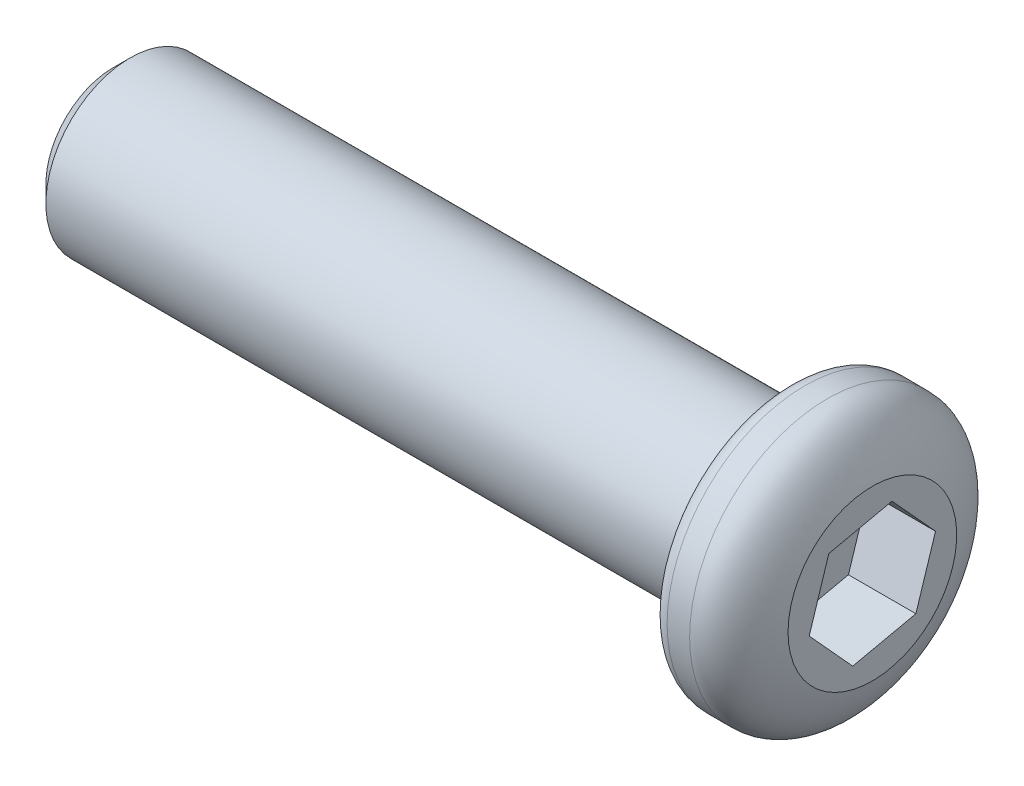
from build123d import *

# Parameters (mm, degrees)
CUT_EXTRUDE1_DEPTH = 1.2
CHAMFER1_SIZE      = 0.3
FILLET1_R          = 0.3


with BuildPart() as part:
    # Sketch1 → Revolve1 (revolve)
    with BuildSketch(Plane(origin=(0, 0, 0), x_dir=(1, 0, 0), z_dir=(0, 1, 0)), mode=Mode.PRIVATE) as revolve1_sk:
        with BuildLine():
            Line((0, 0), (0, 1.5))
            Line((0, 1.5), (12, 1.5))
            Line((12, 1.5), (12, 2.45))
            Line((12, 2.45), (12.7, 2.45))
            add(Edge.make_bspline(
                [(12.7, 2.45), (13.190442748, 2.484618279), (13.5, 1.5)],
                knots=[0, 0, 0, 0.615019669, 0.615019669, 0.615019669], degree=2))
            Line((13.5, 1.5), (13.5, 0))
            Line((13.5, 0), (0, 0))
        make_face()
    revolve(revolve1_sk.sketch.rotate(Axis((-60.710951108, 0, 0), (1, 0, 0)), 180), axis=Axis((-60.710951108, 0, 0), (1, 0, 0)))

    # Sketch2 → Cut-Extrude1 (cut)
    with BuildSketch(Plane(origin=(13.5, 0, 0), x_dir=(0, 0, -1), z_dir=(1, 0, 0))):
        Polygon((0.349309187, 1.095665593), (-0.774219644, 0.850343426), (-1.123528831, -0.245322167), (-0.349309187, -1.095665593), (0.774219644, -0.850343426), (1.123528831, 0.245322167), align=None)
    extrude(amount=-CUT_EXTRUDE1_DEPTH, mode=Mode.SUBTRACT)

    # Chamfer1
    chamfer1_edges = [part.edges().sort_by_distance(p)[0] for p in [
        (0, 0, -1.5),
        (12, 0, -1.5),
    ]]
    chamfer(chamfer1_edges, length=CHAMFER1_SIZE)

    # Fillet1
    fillet1_edges = [part.edges().sort_by_distance(p)[0] for p in [
        (12, 0, -2.45),
    ]]
    fillet(fillet1_edges, radius=FILLET1_R)


solid = part.part
